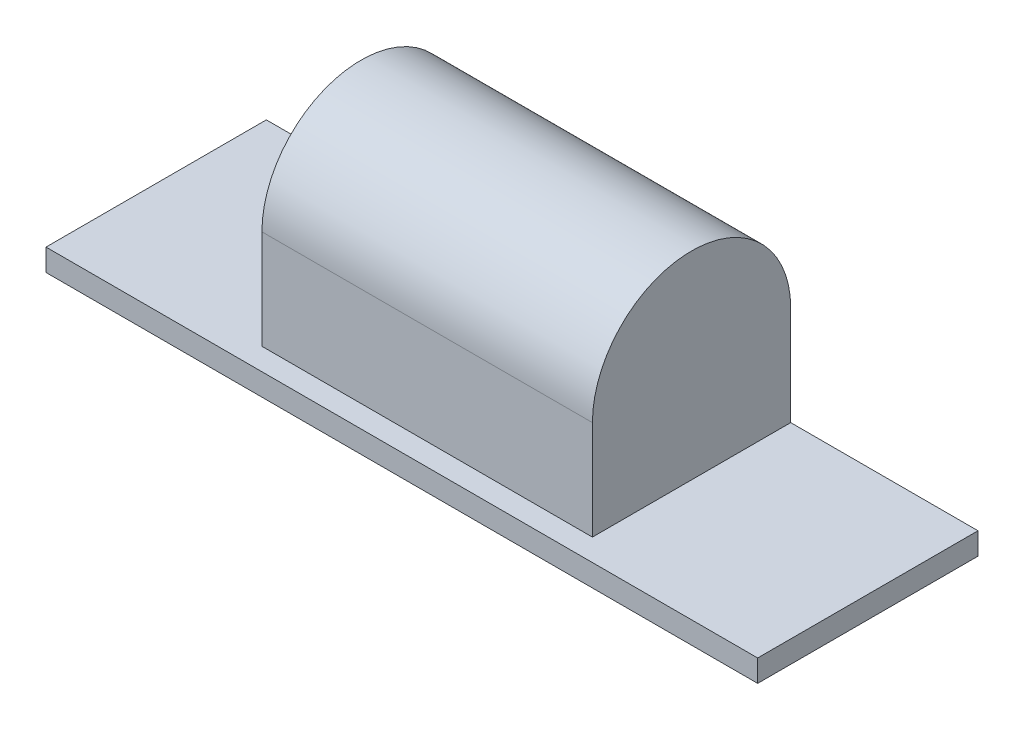
from build123d import *

# Parameters (mm, degrees)
BOSS_EXTRUDE1_DEPTH = 2
SKETCH1_3_W         = 30
SKETCH1_3_H         = 18
BOSS_EXTRUDE2_DEPTH = 20
CUT_EXTRUDE1_DEPTH  = 54.104524665


with BuildPart() as part:
    # Sketch1 → Boss-Extrude1 (new body)
    with BuildSketch(Plane(origin=(0, 0, 0), x_dir=(1, 0, 0), z_dir=(0, 1, 0))):
        Polygon((-14.414477612, 14.528955224), (-32.014477612, 14.528955224), (-32.014477612, -5.471044776), (32.585522388, -5.471044776), (32.585522388, 14.528955224), (15.585522388, 14.528955224), (15.585522388, -3.471044776), (-14.414477612, -3.471044776), align=None)
    extrude(amount=BOSS_EXTRUDE1_DEPTH)

    # Sketch1<3> → Boss-Extrude2 (add)
    with BuildSketch(Plane(origin=(0, 0, 0), x_dir=(1, 0, 0), z_dir=(0, 1, 0))):
        with Locations((0.585522388, 5.528955224)):
            Rectangle(SKETCH1_3_W, SKETCH1_3_H)
    extrude(amount=BOSS_EXTRUDE2_DEPTH)

    # Sketch2 → Cut-Extrude1 (cut, through all)
    with BuildSketch(Plane.ZY.offset(14.414477612)):
        with BuildLine():
            Line((-14.528955224, 20), (-14.528955224, 11))
            ThreePointArc((-14.528955224, 11), (-11.892916255, 17.363961031), (-5.528955224, 20))
            Line((-5.528955224, 20), (-14.528955224, 20))
        make_face()
        with BuildLine():
            ThreePointArc((-5.528955224, 20), (0.835005807, 17.363961031), (3.471044776, 11))
            Line((3.471044776, 11), (3.471044776, 20))
            Line((3.471044776, 20), (-5.528955224, 20))
        make_face()
    extrude(amount=-CUT_EXTRUDE1_DEPTH, mode=Mode.SUBTRACT)


solid = part.part
